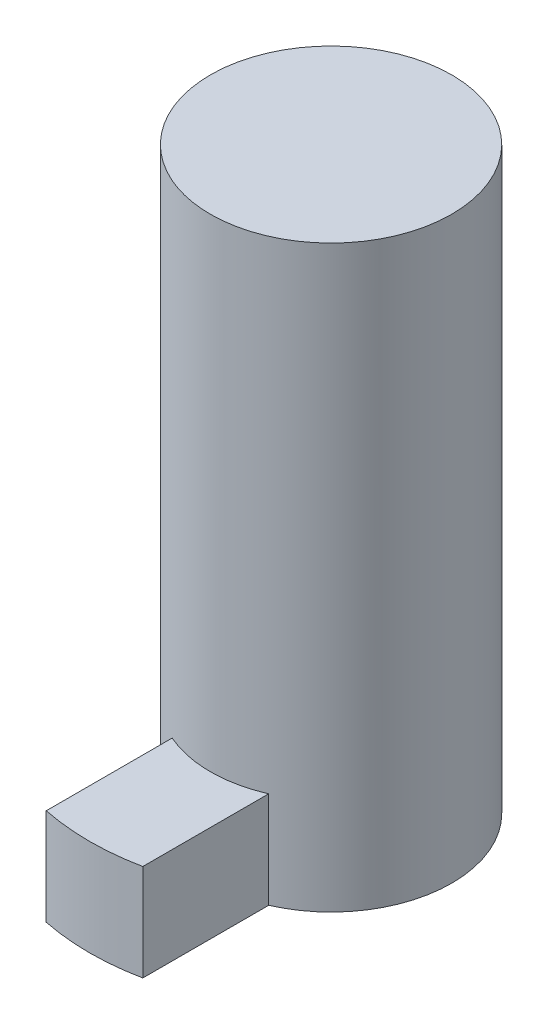
from build123d import *

# Parameters (mm, degrees)
SKETCH1_R           = 1.25
BOSS_EXTRUDE1_DEPTH = 6
BOSS_EXTRUDE3_DEPTH = 1


with BuildPart() as part:
    # Sketch1 → Boss-Extrude1 (new body)
    with BuildSketch(Plane(origin=(0, 0, 0), x_dir=(1, 0, 0), z_dir=(0, 1, 0))):
        with Locations(Location((0, 0, 0), (0, 0, 270))):
            Circle(SKETCH1_R)
    extrude(amount=BOSS_EXTRUDE1_DEPTH)

    # Sketch3 → Boss-Extrude3 (add)
    with BuildSketch(Plane.XZ):
        with BuildLine():
            Line((-0.5, 2.449489743), (-0.5, 1.145643924))
            ThreePointArc((-0.5, 1.145643924), (0, 1.25), (0.5, 1.145643924))
            Line((0.5, 1.145643924), (0.5, 2.449489743))
            ThreePointArc((0.5, 2.449489743), (0, 2.5), (-0.5, 2.449489743))
        make_face()
    extrude(amount=-BOSS_EXTRUDE3_DEPTH)


solid = part.part
